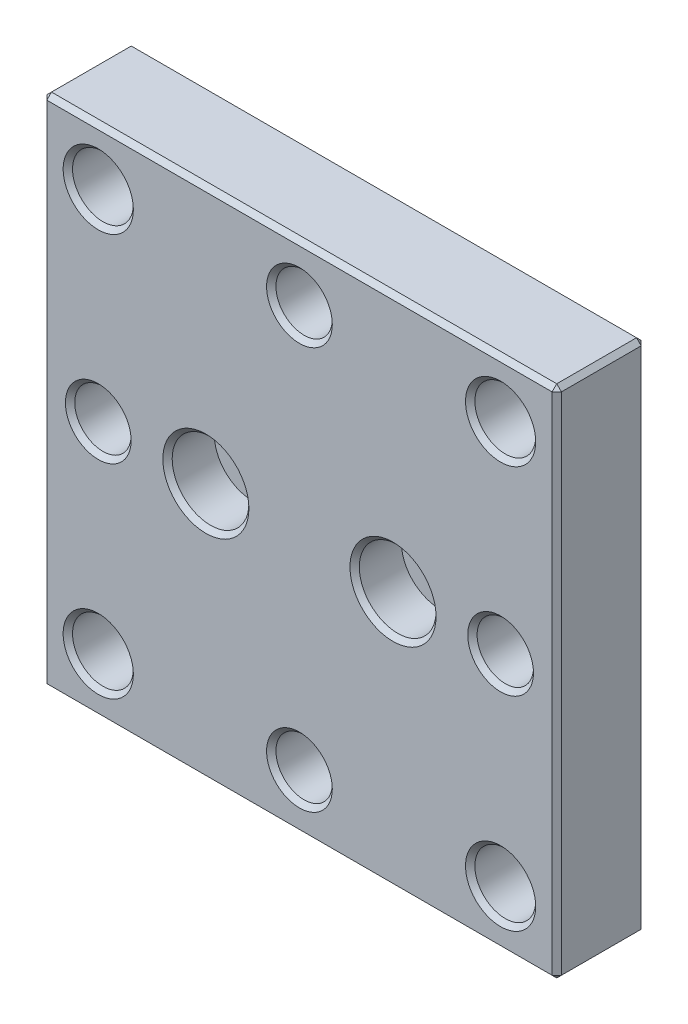
from build123d import *

# Parameters (mm, degrees)
SKETCH1_W           = 55
SKETCH1_H           = 55
SKETCH1_R           = 4.1
BOSS_EXTRUDE1_DEPTH = 9.525
SKETCH1_3_R         = 4.1
SKETCH1_3_R_2       = 2.2
BOSS_EXTRUDE2_DEPTH = 4.525
SKETCH3_R           = 3.0127
CUT_EXTRUDE1_DEPTH  = 79.362782142
SKETCH5_R           = 3.2512
CUT_EXTRUDE2_DEPTH  = 6.4008
CHAMFER1_SIZE       = 0.5
SKETCH6_R           = 1.25
CUT_EXTRUDE3_DEPTH  = 79.362782142
CHAMFER2_SIZE       = 0.5


with BuildPart() as part:
    # Sketch1 → Boss-Extrude1 (new body)
    with BuildSketch(Plane.XY):
        with Locations((27.5, 27.5)):
            Rectangle(SKETCH1_W, SKETCH1_H)
        with Locations((17.5, 27.5)):
            Circle(SKETCH1_R, mode=Mode.SUBTRACT)
        with Locations((37.5, 27.5)):
            Circle(SKETCH1_R, mode=Mode.SUBTRACT)
    extrude(amount=BOSS_EXTRUDE1_DEPTH)

    # Sketch1<3> → Boss-Extrude2 (add)
    # profile 1 of 2: a face of its own
    with BuildSketch(Plane.XY):
        with Locations((17.5, 27.5)):
            Circle(SKETCH1_3_R)
        with Locations((17.5, 27.5)):
            Circle(SKETCH1_3_R_2, mode=Mode.SUBTRACT)
    # profile 2 of 2: a face of its own
    with BuildSketch(Plane.XY):
        with Locations((37.5, 27.5)):
            Circle(SKETCH1_3_R)
        with Locations((37.5, 27.5)):
            Circle(SKETCH1_3_R_2, mode=Mode.SUBTRACT)
    extrude(amount=BOSS_EXTRUDE2_DEPTH)

    # Sketch3 → Cut-Extrude1 (cut, through all)
    with BuildSketch(Plane.XY.offset(9.525)):
        with Locations((27.5, 49)):
            Circle(SKETCH3_R)
        with Locations((6, 27.5)):
            Circle(SKETCH3_R)
        with Locations((49, 27.5)):
            Circle(SKETCH3_R)
        with Locations((27.5, 6)):
            Circle(SKETCH3_R)
    extrude(amount=-CUT_EXTRUDE1_DEPTH, mode=Mode.SUBTRACT)

    # Sketch5 → Cut-Extrude2 (cut)
    with BuildSketch(Plane.XY.offset(9.525)):
        with Locations((6, 49)):
            Circle(SKETCH5_R)
        with Locations((49, 49)):
            Circle(SKETCH5_R)
        with Locations((49, 6)):
            Circle(SKETCH5_R)
        with Locations((6, 6)):
            Circle(SKETCH5_R)
    extrude(amount=-CUT_EXTRUDE2_DEPTH, mode=Mode.SUBTRACT)

    # Chamfer1
    chamfer1_edges = [part.edges().sort_by_distance(p)[0] for p in [
        (45.9873, 27.5, 0),
        (35.3, 27.5, 0),
        (24.4873, 49, 0),
        (24.4873, 6, 0),
        (15.3, 27.5, 0),
        (2.9873, 27.5, 0),
        (2.7488, 49, 9.525),
        (2.7488, 6, 9.525),
        (2.9873, 27.5, 9.525),
        (13.4, 27.5, 9.525),
        (33.4, 27.5, 9.525),
        (24.4873, 6, 9.525),
        (45.7488, 6, 9.525),
        (45.9873, 27.5, 9.525),
        (45.7488, 49, 9.525),
        (24.4873, 49, 9.525),
        (27.5, 55, 0),
        (55, 55, 4.7625),
        (55, 27.5, 0),
        (55, 0, 4.7625),
        (27.5, 0, 0),
        (0, 27.5, 0),
        (0, 55, 4.7625),
        (0, 0, 4.7625),
        (55, 27.5, 9.525),
        (27.5, 0, 9.525),
        (0, 27.5, 9.525),
        (27.5, 55, 9.525),
    ]]
    chamfer(chamfer1_edges, length=CHAMFER1_SIZE)

    # Sketch6 → Cut-Extrude3 (cut, through all)
    with BuildSketch(Plane.XY.offset(9.525)):
        with Locations((6, 49)):
            Circle(SKETCH6_R)
        with Locations((49, 49)):
            Circle(SKETCH6_R)
        with Locations((49, 6)):
            Circle(SKETCH6_R)
        with Locations((6, 6)):
            Circle(SKETCH6_R)
    extrude(amount=-CUT_EXTRUDE3_DEPTH, mode=Mode.SUBTRACT)

    # Chamfer2
    chamfer2_edges = [part.edges().sort_by_distance(p)[0] for p in [
        (4.75, 6, 3.1242),
        (47.75, 6, 3.1242),
        (47.75, 49, 3.1242),
        (4.75, 49, 3.1242),
        (4.75, 49, 0),
        (47.75, 49, 0),
        (47.75, 6, 0),
        (4.75, 6, 0),
    ]]
    chamfer(chamfer2_edges, length=CHAMFER2_SIZE)


solid = part.part
